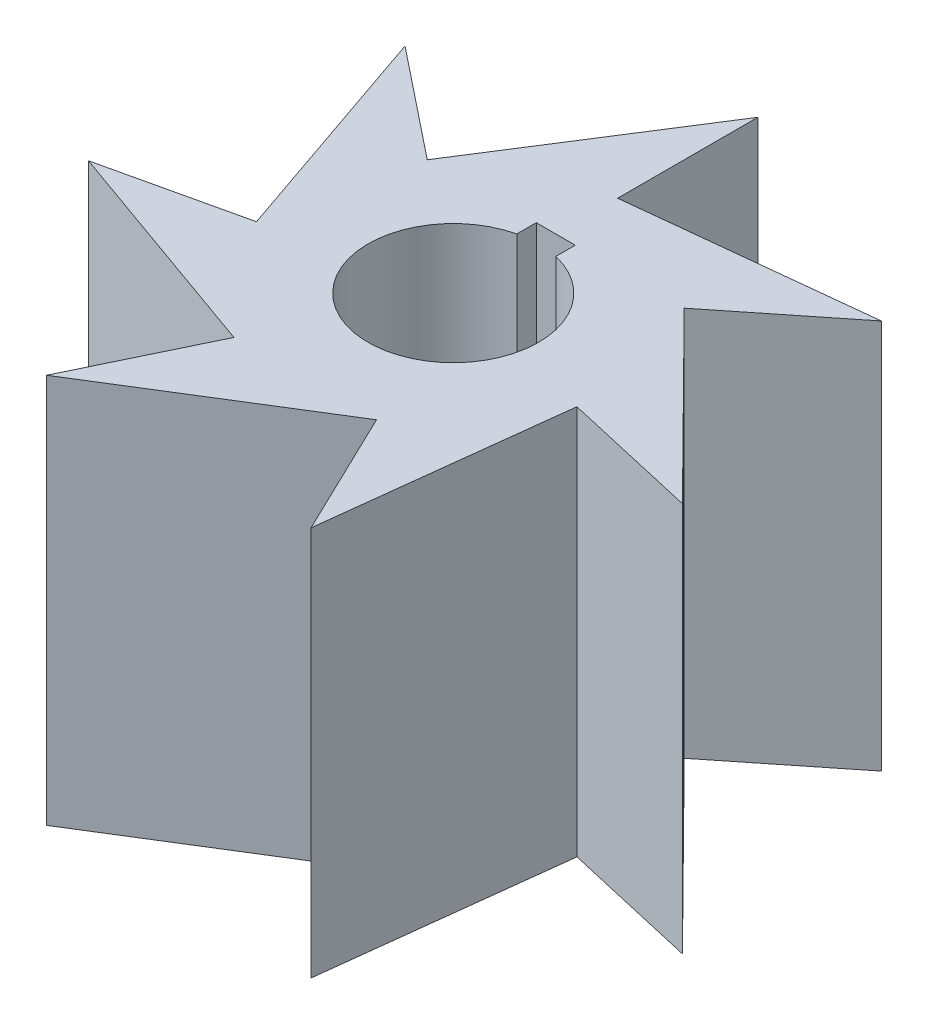
from build123d import *

# Parameters (mm, degrees)
BOSS_EXTRUDE1_DEPTH = 80


with BuildPart() as part:
    # Sketch1 → Boss-Extrude1 (new body)
    with BuildSketch(Plane(origin=(0, 0, 0), x_dir=(1, 0, 0), z_dir=(0, 1, 0))):
        Polygon((0, 33.721419827), (0, 62.5), (-26.364467654, 21.024961366), (-48.864467654, 38.968112616), (-32.875953428, -7.503721834), (-60.932994511, -13.907558372), (-14.631175723, -30.381949446), (-27.117733695, -56.310554244), (14.631175723, -30.381949446), (27.117733695, -56.310554244), (32.875953428, -7.503721834), (60.932994511, -13.907558372), (26.364467654, 21.024961366), (48.864467654, 38.968112616), align=None)
        with BuildLine():
            Line((-4, 17.036725037), (-4, 21.036725037))
            Line((-4, 21.036725037), (4, 21.036725037))
            Line((4, 21.036725037), (4, 17.036725037))
            ThreePointArc((4, 17.036725037), (0, -17.5), (-4, 17.036725037))
        make_face(mode=Mode.SUBTRACT)
    extrude(amount=BOSS_EXTRUDE1_DEPTH)


solid = part.part
